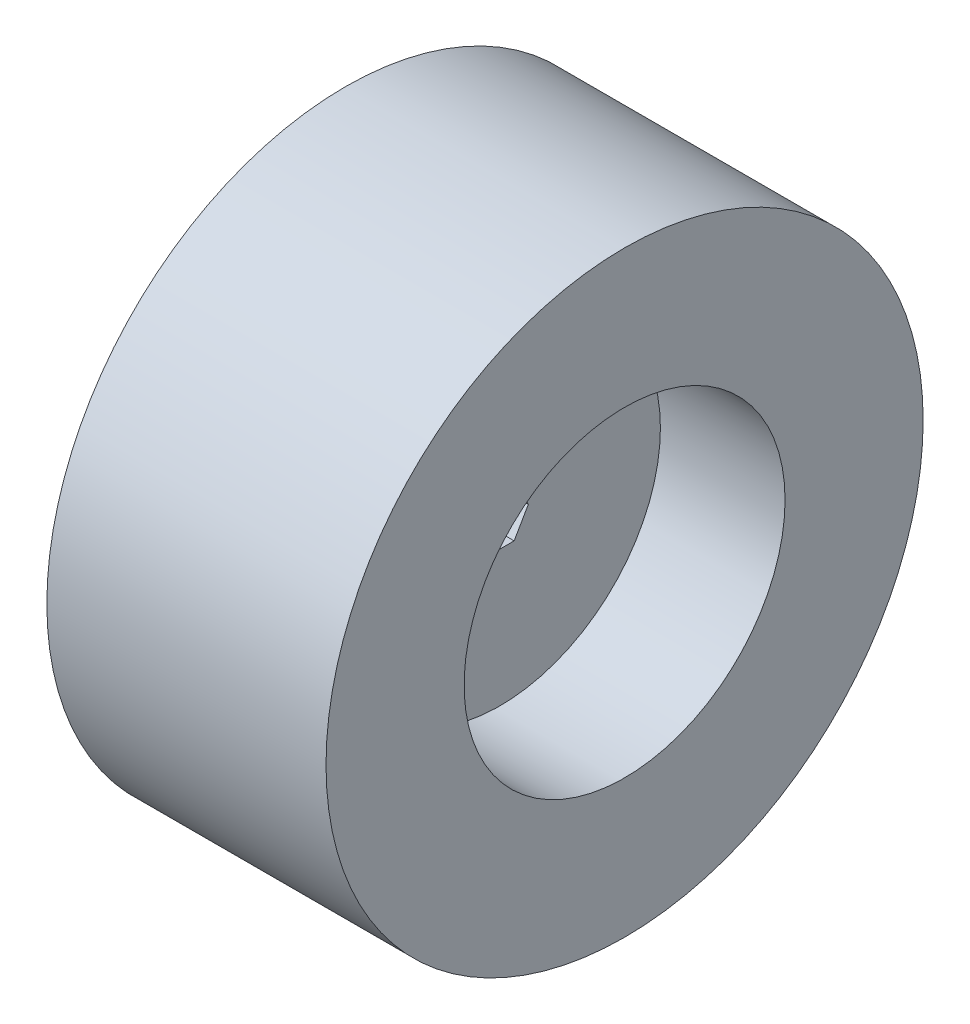
from build123d import *

# Parameters (mm, degrees)
SKETCH1_R           = 40
SKETCH1_R_2         = 21.5
BOSS_EXTRUDE1_DEPTH = 37.4
SKETCH1_3_R         = 21.5
BOSS_EXTRUDE2_DEPTH = 20.7
SKETCH1_5_R         = 1.5
BOSS_EXTRUDE3_DEPTH = 10.45


with BuildPart() as part:
    # Sketch1 → Boss-Extrude1 (new body)
    with BuildSketch(Plane(origin=(0, 0, 0), x_dir=(0, 0, -1), z_dir=(1, 0, 0))):
        Circle(SKETCH1_R)
        Circle(SKETCH1_R_2, mode=Mode.SUBTRACT)
    extrude(amount=BOSS_EXTRUDE1_DEPTH)

    # Sketch1<3> → Boss-Extrude2 (add)
    with BuildSketch(Plane(origin=(0, 0, 0), x_dir=(0, 0, -1), z_dir=(1, 0, 0))):
        Circle(SKETCH1_3_R)
        Polygon((1.905, 3.299556788), (3.81, 0), (1.905, -3.299556788), (-1.905, -3.299556788), (-3.81, 0), (-1.905, 3.299556788), align=None, mode=Mode.SUBTRACT)
    extrude(amount=BOSS_EXTRUDE2_DEPTH)

    # Sketch1<5> → Boss-Extrude3 (add)
    with BuildSketch(Plane(origin=(0, 0, 0), x_dir=(0, 0, -1), z_dir=(1, 0, 0))):
        Polygon((1.905, -3.299556788), (3.81, 0), (1.905, 3.299556788), (-1.905, 3.299556788), (-3.81, 0), (-1.905, -3.299556788), align=None)
        Circle(SKETCH1_5_R, mode=Mode.SUBTRACT)
    extrude(amount=BOSS_EXTRUDE3_DEPTH)


solid = part.part
